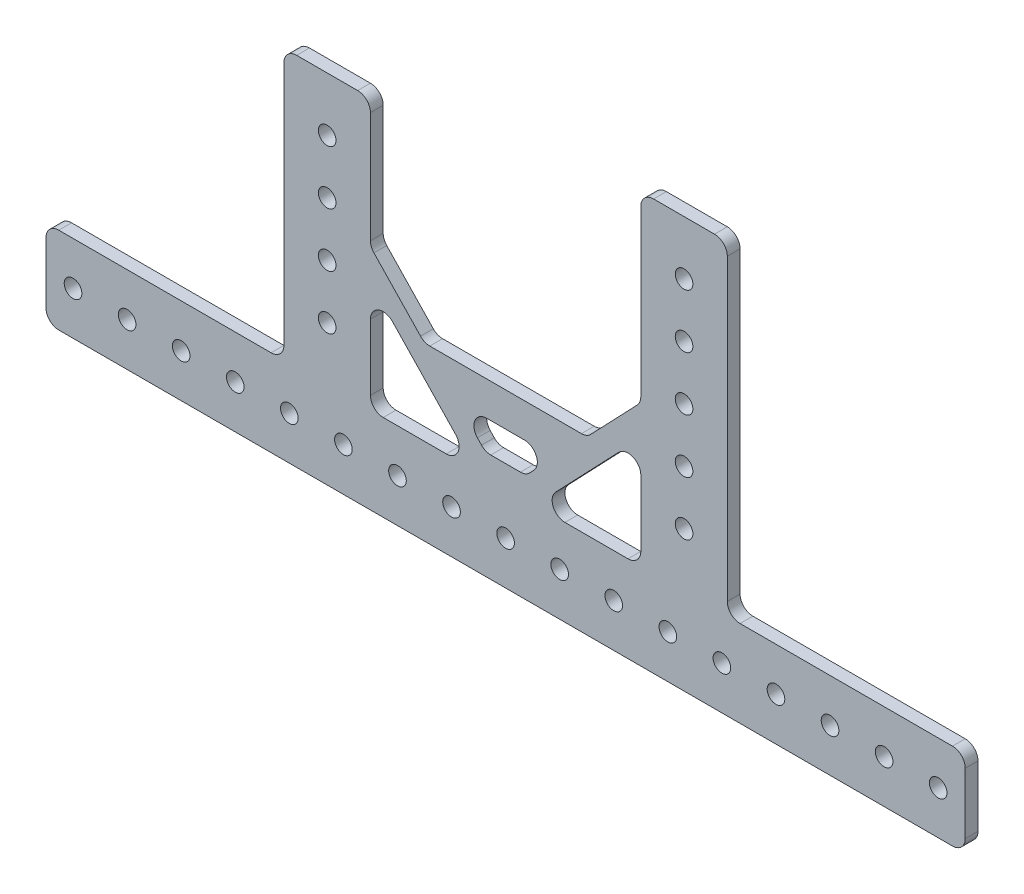
from build123d import *

# Parameters (mm, degrees)
SKETCH1_R           = 2.07
BOSS_EXTRUDE1_DEPTH = 1.5
FILLET3_R           = 3
BOSS_EXTRUDE5_DEPTH = 3
BOSS_EXTRUDE6_DEPTH = 3
FILLET4_R           = 3


with BuildPart() as part:
    # Sketch1 → Boss-Extrude1 (new, symmetric)
    with BuildSketch(Plane.XY):
        Polygon((-107.95, 10.16), (-52.07, 10.16), (-52.07, 73.66), (-31.75, 73.66), (-31.75, 10.16), (31.75, 10.16), (31.75, 86.36), (52.07, 86.36), (52.07, 10.16), (107.95, 10.16), (107.95, -10.16), (-107.95, -10.16), align=None)
        Circle(SKETCH1_R, mode=Mode.SUBTRACT)
        with Locations((12.7, 0)):
            Circle(SKETCH1_R, mode=Mode.SUBTRACT)
        with Locations((25.4, 0)):
            Circle(SKETCH1_R, mode=Mode.SUBTRACT)
        with Locations((38.1, 0)):
            Circle(SKETCH1_R, mode=Mode.SUBTRACT)
        with Locations((50.8, 0)):
            Circle(SKETCH1_R, mode=Mode.SUBTRACT)
        with Locations((63.5, 0)):
            Circle(SKETCH1_R, mode=Mode.SUBTRACT)
        with Locations((76.2, 0)):
            Circle(SKETCH1_R, mode=Mode.SUBTRACT)
        with Locations((88.9, 0)):
            Circle(SKETCH1_R, mode=Mode.SUBTRACT)
        with Locations((101.6, 0)):
            Circle(SKETCH1_R, mode=Mode.SUBTRACT)
        with Locations((-12.7, 0)):
            Circle(SKETCH1_R, mode=Mode.SUBTRACT)
        with Locations((-25.4, 0)):
            Circle(SKETCH1_R, mode=Mode.SUBTRACT)
        with Locations((-38.1, 0)):
            Circle(SKETCH1_R, mode=Mode.SUBTRACT)
        with Locations((-50.8, 0)):
            Circle(SKETCH1_R, mode=Mode.SUBTRACT)
        with Locations((-63.5, 0)):
            Circle(SKETCH1_R, mode=Mode.SUBTRACT)
        with Locations((-76.2, 0)):
            Circle(SKETCH1_R, mode=Mode.SUBTRACT)
        with Locations((-88.9, 0)):
            Circle(SKETCH1_R, mode=Mode.SUBTRACT)
        with Locations((-101.6, 0)):
            Circle(SKETCH1_R, mode=Mode.SUBTRACT)
        with Locations((-41.91, 60.96)):
            Circle(SKETCH1_R, mode=Mode.SUBTRACT)
        with Locations(Location((41.91, 60.96, 0), (0, 0, 180))):
            Circle(SKETCH1_R, mode=Mode.SUBTRACT)
        with Locations((-41.91, 48.26)):
            Circle(SKETCH1_R, mode=Mode.SUBTRACT)
        with Locations(Location((41.91, 48.26, 0), (0, 0, 180))):
            Circle(SKETCH1_R, mode=Mode.SUBTRACT)
        with Locations((-41.91, 35.56)):
            Circle(SKETCH1_R, mode=Mode.SUBTRACT)
        with Locations(Location((41.91, 35.56, 0), (0, 0, 180))):
            Circle(SKETCH1_R, mode=Mode.SUBTRACT)
        with Locations((-41.91, 22.86)):
            Circle(SKETCH1_R, mode=Mode.SUBTRACT)
        with Locations(Location((41.91, 22.86, 0), (0, 0, 180))):
            Circle(SKETCH1_R, mode=Mode.SUBTRACT)
        with Locations((41.91, 73.66)):
            Circle(SKETCH1_R, mode=Mode.SUBTRACT)
    extrude(amount=BOSS_EXTRUDE1_DEPTH, both=True)

    # Fillet3
    fillet3_edges = [part.edges().sort_by_distance(p)[0] for p in [
        (107.95, -10.16, 0),
        (-107.95, -10.16, 0),
        (-107.95, 10.16, 0),
        (-52.07, 10.16, 0),
        (-52.07, 73.66, 0),
        (-31.75, 10.16, 0),
        (31.75, 10.16, 0),
        (52.07, 86.36, 0),
        (52.07, 10.16, 0),
        (107.95, 10.16, 0),
    ]]
    fillet(fillet3_edges, radius=FILLET3_R)

    # Sketch3 → Boss-Extrude5 (add)
    with BuildSketch(Plane.XY.offset(1.5)):
        Polygon((-4.77443609, 15.16), (-31.75, 43.41), (-31.75, 36.169972042), (-6.913410156, 10.16), (6.913410156, 10.16), (31.75, 36.169972042), (31.75, 43.41), (4.77443609, 15.16), align=None)
    extrude(amount=-BOSS_EXTRUDE5_DEPTH)

    # Sketch4 → Boss-Extrude6 (add)
    with BuildSketch(Plane.XY.offset(1.5)):
        Polygon((19.097744361, 30.16), (-19.097744361, 30.16), (-11.458646617, 22.16), (11.458646617, 22.16), align=None)
    extrude(amount=-BOSS_EXTRUDE6_DEPTH)

    # Fillet4
    fillet4_edges = [part.edges().sort_by_distance(p)[0] for p in [
        (-31.75, 73.66, 0),
        (-31.75, 36.169972042, 0),
        (31.75, 86.36, 0),
        (-31.75, 43.41, 0),
        (-4.77443609, 15.16, 0),
        (4.77443609, 15.16, 0),
        (31.75, 43.41, 0),
        (31.75, 36.169972042, 0),
        (6.913410156, 10.16, 0),
        (-6.913410156, 10.16, 0),
        (19.097744361, 30.16, 0),
        (11.458646617, 22.16, 0),
        (-11.458646617, 22.16, 0),
        (-19.097744361, 30.16, 0),
    ]]
    fillet(fillet4_edges, radius=FILLET4_R)


solid = part.part
